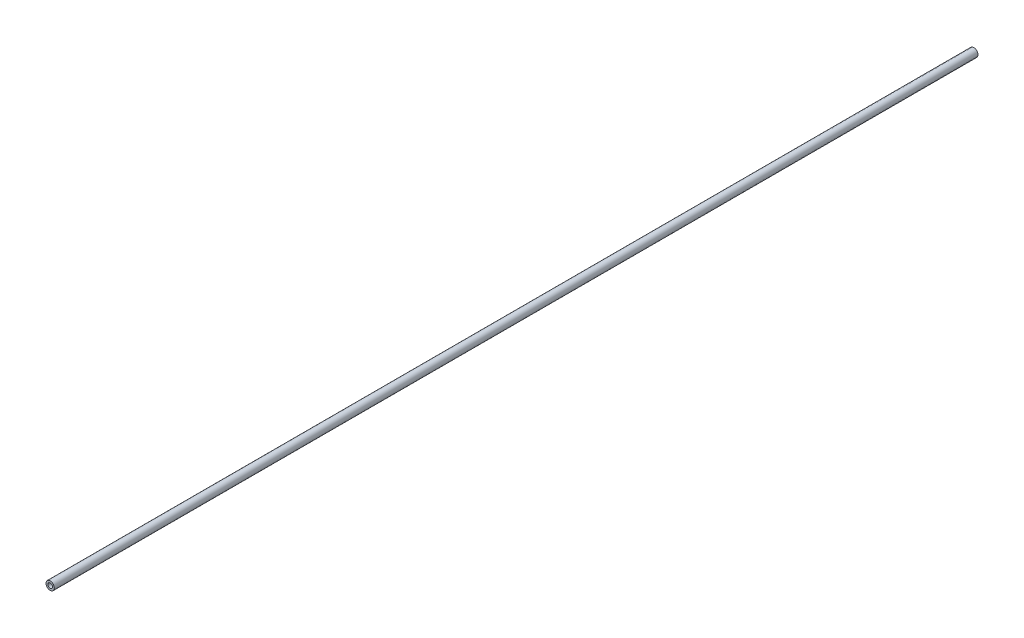
from build123d import *

# Parameters (mm, degrees)
SKETCH1_R           = 6.858
SKETCH1_R_2         = 3.8354
EXTRUDE_THIN1_DEPTH = 762


with BuildPart() as part:
    # Sketch1 → Extrude-Thin1 (new, symmetric)
    with BuildSketch(Plane.XY):
        Circle(SKETCH1_R)
        Circle(SKETCH1_R_2, mode=Mode.SUBTRACT)
    extrude(amount=EXTRUDE_THIN1_DEPTH, both=True)


solid = part.part
